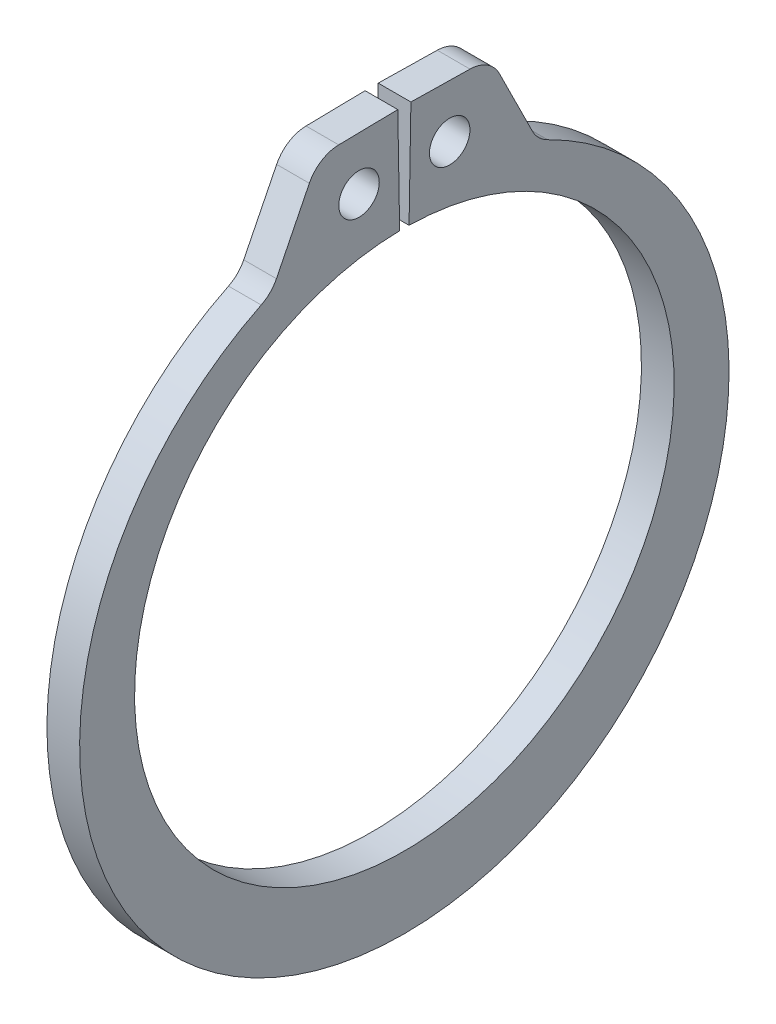
from build123d import *

# Parameters (mm, degrees)
SKETCH1_R      = 0.6604
EXTRUDE1_DEPTH = 0.5334
FILLET1_R      = 1.0922


with BuildPart() as part:
    # Sketch1 → Extrude1 (new, symmetric)
    with BuildSketch(Plane(origin=(0, 0, 0), x_dir=(0, 0, -1), z_dir=(1, 0, 0))):
        with BuildLine():
            Line((-0.153600374, 8.79975955), (-0.213887967, 12.253633428))
            Line((-0.213887967, 12.253633428), (-2.804293376, 12.208417733))
            Line((-2.804293376, 12.208417733), (-4.342027289, 9.115158324))
            ThreePointArc((-4.342027289, 9.115158324), (0, -11.1379), (4.342027289, 9.115158324))
            Line((4.342027289, 9.115158324), (2.804293376, 12.208417733))
            Line((2.804293376, 12.208417733), (0.213887967, 12.253633428))
            Line((0.213887967, 12.253633428), (0.153600374, 8.79975955))
            ThreePointArc((0.153600374, 8.79975955), (0, -8.8011), (-0.153600374, 8.79975955))
        make_face()
        with Locations((-1.478946875, 10.504088642)):
            Circle(SKETCH1_R, mode=Mode.SUBTRACT)
        with Locations((1.478946875, 10.504088642)):
            Circle(SKETCH1_R, mode=Mode.SUBTRACT)
    extrude(amount=EXTRUDE1_DEPTH, both=True)

    # Fillet1
    fillet1_edges = [part.edges().sort_by_distance(p)[0] for p in [
        (0, 12.208417733, -2.804293376),
        (0, 9.115158324, -4.342027289),
        (0, 9.115158324, 4.342027289),
        (0, 12.208417733, 2.804293376),
    ]]
    fillet(fillet1_edges, radius=FILLET1_R)


solid = part.part
